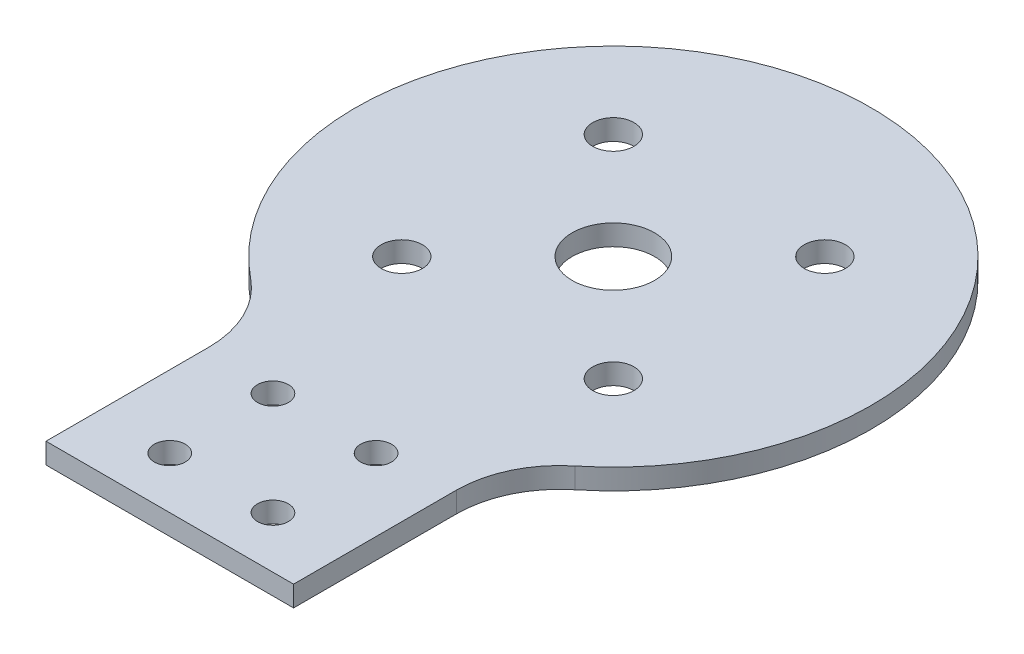
from build123d import *

# Parameters (mm, degrees)
SKETCH_2_R          = 6
SKETCH_2_R_2        = 4
EXTRUDE_1_DEPTH     = 2
SKETCH_4_R          = 25
SKETCH_4_R_2        = 5
SKETCH_4_R_3        = 2
EXTRUDE_3_DEPTH     = 2
SKETCH_3_W          = 24
SKETCH_3_H          = 21.068287801
EXTRUDE_2_DEPTH     = 2
SKETCH_5_R          = 1.5
CUT_EXTRUDE_1_DEPTH = 50.779513859
FILLET_1_R          = 10


with BuildPart() as part:
    # 草图2 → 凸台-拉伸1 (new body)
    with BuildSketch(Plane(origin=(0, 0, 0), x_dir=(1, 0, 0), z_dir=(0, 1, 0))):
        with Locations(Location((0, 0, 0), (0, 0, 270))):
            Circle(SKETCH_2_R)
        with Locations(Location((0, 0, 0), (0, 0, 270))):
            Circle(SKETCH_2_R_2, mode=Mode.SUBTRACT)
    extrude(amount=EXTRUDE_1_DEPTH)

    # 草图4 → 凸台-拉伸3 (add)
    with BuildSketch(Plane(origin=(0, 2, 0), x_dir=(1, 0, 0), z_dir=(0, 1, 0))):
        with Locations(Location((0, 0, 0), (0, 0, 270))):
            Circle(SKETCH_4_R)
        Circle(SKETCH_4_R_2, mode=Mode.SUBTRACT)
        with Locations(Location((-10.253048327, 10.253048327, 0), (0, 0, 270))):
            Circle(SKETCH_4_R_3, mode=Mode.SUBTRACT)
        with Locations(Location((10.253048327, 10.253048327, 0), (0, 0, 270))):
            Circle(SKETCH_4_R_3, mode=Mode.SUBTRACT)
        with Locations(Location((-10.253048327, -10.253048327, 0), (0, 0, 270))):
            Circle(SKETCH_4_R_3, mode=Mode.SUBTRACT)
        with Locations(Location((10.253048327, -10.253048327, 0), (0, 0, 270))):
            Circle(SKETCH_4_R_3, mode=Mode.SUBTRACT)
    extrude(amount=-EXTRUDE_3_DEPTH)

    # 草图3 → 凸台-拉伸2 (add)
    with BuildSketch(Plane(origin=(0, 2, 0), x_dir=(1, 0, 0), z_dir=(0, 1, 0))):
        with Locations((0, -32.4658561)):
            Rectangle(SKETCH_3_W, SKETCH_3_H)
    extrude(amount=-EXTRUDE_2_DEPTH)

    # 草图5 → 切除-拉伸1 (cut, through all)
    with BuildSketch(Plane(origin=(0, 2, 0), x_dir=(1, 0, 0), z_dir=(0, 1, 0))):
        with Locations(Location((5, -28, 0), (0, 0, 270))):
            Circle(SKETCH_5_R)
        with Locations(Location((5, -38, 0), (0, 0, 270))):
            Circle(SKETCH_5_R)
        with Locations(Location((-5, -28, 0), (0, 0, 270))):
            Circle(SKETCH_5_R)
        with Locations(Location((-5, -38, 0), (0, 0, 270))):
            Circle(SKETCH_5_R)
    extrude(amount=-CUT_EXTRUDE_1_DEPTH, mode=Mode.SUBTRACT)

    # 圆角1
    fillet_1_edges = [part.edges().sort_by_distance(p)[0] for p in [
        (12, 1, 21.931712199),
        (-12, 1, 21.931712199),
    ]]
    fillet(fillet_1_edges, radius=FILLET_1_R)


solid = part.part
